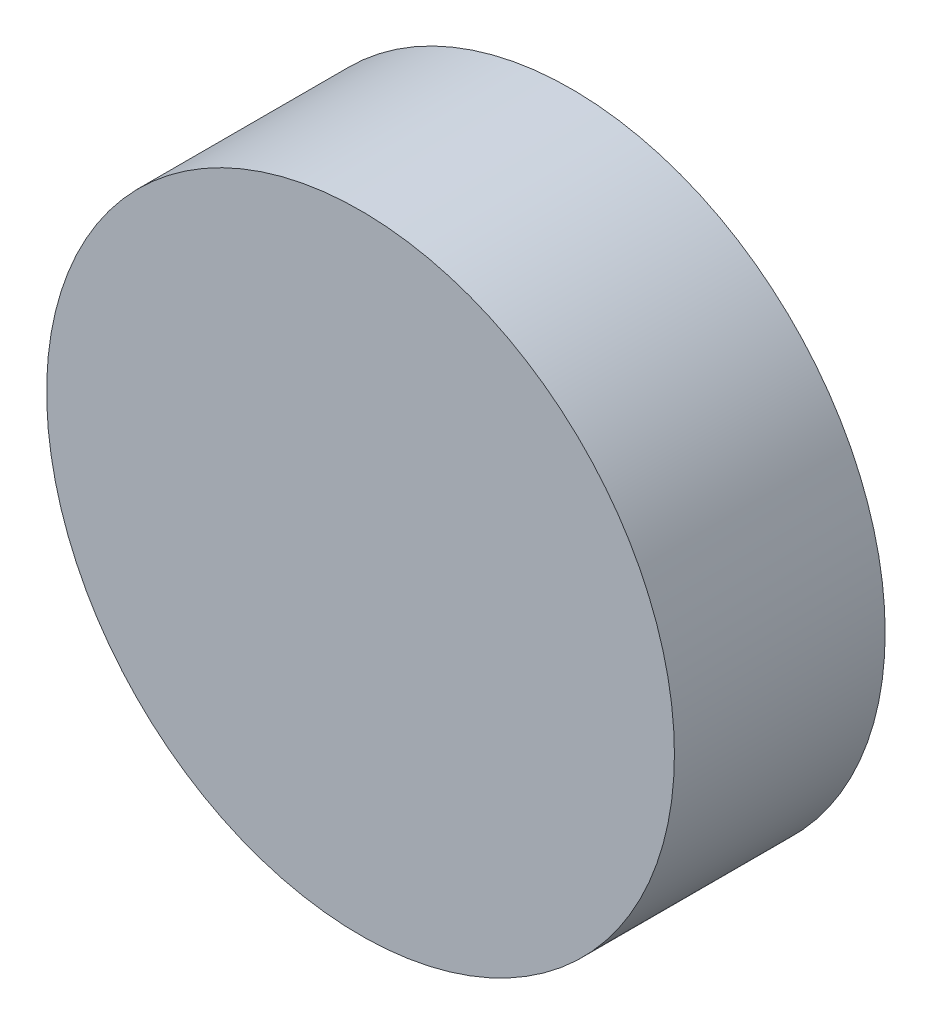
from build123d import *

# Parameters (mm, degrees)
SKETCH1_R           = 14
BOSS_EXTRUDE1_DEPTH = 9.4


with BuildPart() as part:
    # Sketch1 → Boss-Extrude1 (new body)
    with BuildSketch(Plane.XY):
        Circle(SKETCH1_R)
    extrude(amount=BOSS_EXTRUDE1_DEPTH)


solid = part.part
